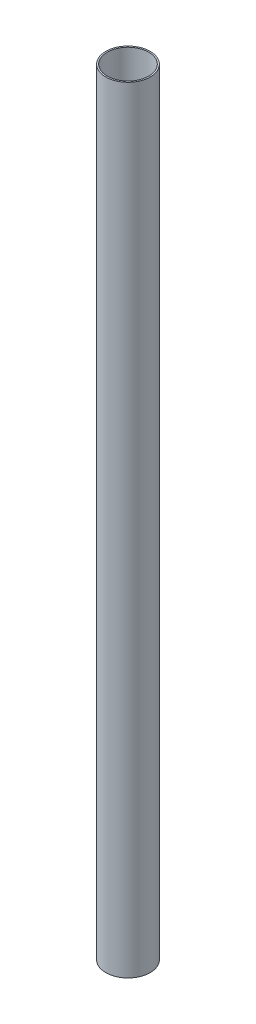
from build123d import *

# Parameters (mm, degrees)
CROQUIS1_R              = 22.5
CROQUIS1_R_2            = 21
SALIENTE_EXTRUIR1_DEPTH = 785
CROQUIS2_W              = 10
CROQUIS2_H              = 60
CORTAR_EXTRUIR1_DEPTH   = 785


with BuildPart() as part:
    # Croquis1 → Saliente-Extruir1 (new body)
    with BuildSketch(Plane(origin=(0, 0, 0), x_dir=(1, 0, 0), z_dir=(0, 1, 0))):
        with Locations(Location((0, 0, 0), (0, 0, 270))):
            Circle(CROQUIS1_R)
        with Locations(Location((0, 0, 0), (0, 0, 270))):
            Circle(CROQUIS1_R_2, mode=Mode.SUBTRACT)
    extrude(amount=SALIENTE_EXTRUIR1_DEPTH)

    # Croquis2 → Cortar-Extruir1 (cut)
    with BuildSketch(Plane.XY):
        with Locations((0, 190)):
            Rectangle(CROQUIS2_W, CROQUIS2_H)
    extrude(amount=-CORTAR_EXTRUIR1_DEPTH, mode=Mode.SUBTRACT)


solid = part.part
